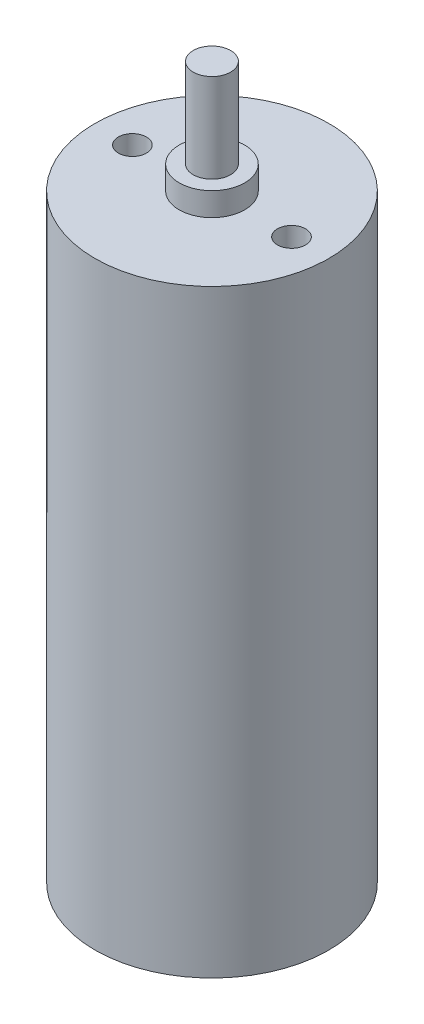
from build123d import *

# Parameters (mm, degrees)
CROQUIS1_R              = 12.5
SALIENTE_EXTRUIR1_DEPTH = 64
CROQUIS2_R              = 1.5
CORTAR_EXTRUIR1_DEPTH   = 40
CROQUIS3_R              = 3.5
SALIENTE_EXTRUIR2_DEPTH = 2.5
CROQUIS4_R              = 2
SALIENTE_EXTRUIR3_DEPTH = 9.5


with BuildPart() as part:
    # Croquis1 → Saliente-Extruir1 (new body)
    with BuildSketch(Plane(origin=(0, 0, 0), x_dir=(1, 0, 0), z_dir=(0, 1, 0))):
        with Locations(Location((0, 0, 0), (0, 0, 270))):
            Circle(CROQUIS1_R)
    extrude(amount=SALIENTE_EXTRUIR1_DEPTH)

    # Croquis2 → Cortar-Extruir1 (cut)
    with BuildSketch(Plane(origin=(0, 64, 0), x_dir=(1, 0, 0), z_dir=(0, 1, 0))):
        with Locations(Location((-8.5, 0, 0), (0, 0, 270))):
            Circle(CROQUIS2_R)
        with Locations(Location((8.5, 0, 0), (0, 0, 270))):
            Circle(CROQUIS2_R)
    extrude(amount=-CORTAR_EXTRUIR1_DEPTH, mode=Mode.SUBTRACT)

    # Croquis3 → Saliente-Extruir2 (add)
    with BuildSketch(Plane(origin=(0, 64, 0), x_dir=(1, 0, 0), z_dir=(0, 1, 0))):
        with Locations(Location((0, 0, 0), (0, 0, 270))):
            Circle(CROQUIS3_R)
    extrude(amount=SALIENTE_EXTRUIR2_DEPTH)

    # Croquis4 → Saliente-Extruir3 (add)
    with BuildSketch(Plane(origin=(0, 66.5, 0), x_dir=(1, 0, 0), z_dir=(0, 1, 0))):
        with Locations(Location((0, 0, 0), (0, 0, 270))):
            Circle(CROQUIS4_R)
    extrude(amount=SALIENTE_EXTRUIR3_DEPTH)


solid = part.part
